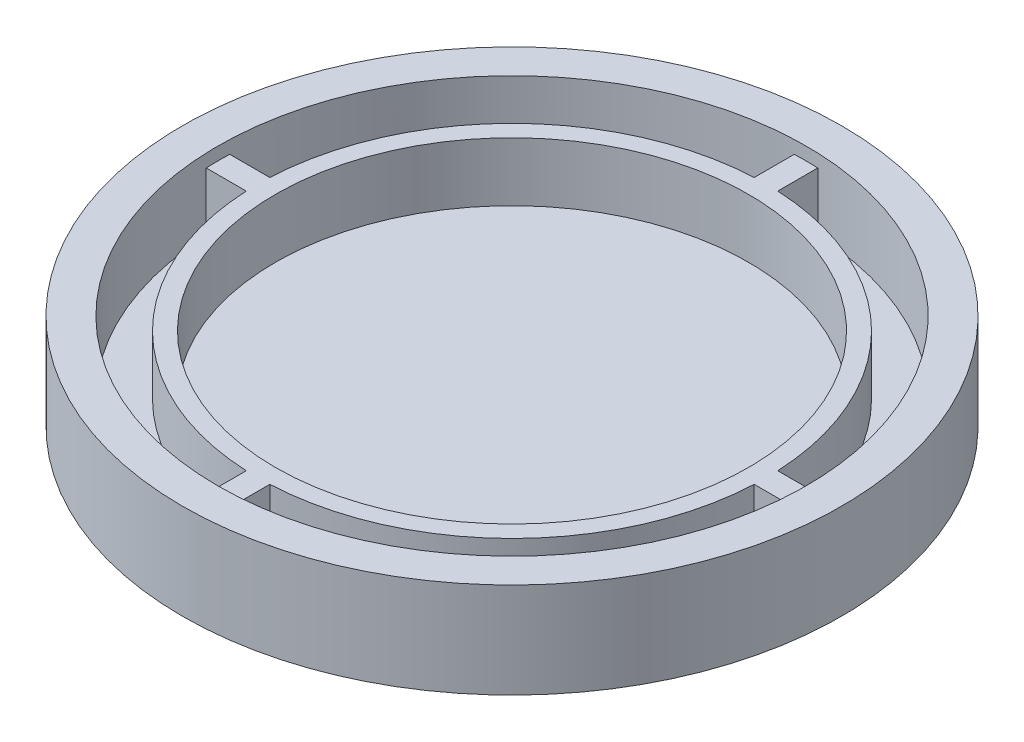
from build123d import *

# Parameters (mm, degrees)
SKETCH1_R           = 28
SKETCH1_R_2         = 25
BOSS_EXTRUDE1_DEPTH = 8
BOSS_EXTRUDE2_START = -2
SKETCH1_3_R         = 28
BOSS_EXTRUDE2_DEPTH = 2
SKETCH1_5_R         = 21.6
SKETCH1_5_R_2       = 20.1
BOSS_EXTRUDE3_DEPTH = 5
CUT_EXTRUDE1_START  = -1.9
SKETCH5_R           = 28
CUT_EXTRUDE1_DEPTH  = 1.9
SKETCH10_W          = 2
SKETCH10_H          = 3.423160565
SKETCH10_W_2        = 3.423160565
SKETCH10_H_2        = 2
BOSS_EXTRUDE4_DEPTH = 5


with BuildPart() as part:
    # Sketch1 → Boss-Extrude1 (new body)
    with BuildSketch(Plane(origin=(0, 0, 0), x_dir=(1, 0, 0), z_dir=(0, 1, 0))):
        with Locations(Location((0, 0, 0), (0, 0, 270))):
            Circle(SKETCH1_R)
        with Locations(Location((0, 0, 0), (0, 0, 270))):
            Circle(SKETCH1_R_2, mode=Mode.SUBTRACT)
    extrude(amount=BOSS_EXTRUDE1_DEPTH)

    # Sketch1<3> → Boss-Extrude2 (add)
    with BuildSketch(Plane(origin=(0, 0, 0), x_dir=(1, 0, 0), z_dir=(0, 1, 0)).offset(BOSS_EXTRUDE2_START)):
        with Locations(Location((0, 0, 0), (0, 0, 270))):
            Circle(SKETCH1_3_R)
    extrude(amount=BOSS_EXTRUDE2_DEPTH)

    # Sketch1<5> → Boss-Extrude3 (add)
    with BuildSketch(Plane(origin=(0, 0, 0), x_dir=(1, 0, 0), z_dir=(0, 1, 0))):
        with Locations(Location((0, 0, 0), (0, 0, 270))):
            Circle(SKETCH1_5_R)
        with Locations(Location((0, 0, 0), (0, 0, 270))):
            Circle(SKETCH1_5_R_2, mode=Mode.SUBTRACT)
    extrude(amount=BOSS_EXTRUDE3_DEPTH)

    # Sketch5 → Cut-Extrude1 (cut)
    with BuildSketch(Plane(origin=(0, 8, 0), x_dir=(1, 0, 0), z_dir=(0, 1, 0)).offset(CUT_EXTRUDE1_START)):
        with Locations(Location((0, 0, 0), (0, 0, 270))):
            Circle(SKETCH5_R)
    extrude(amount=CUT_EXTRUDE1_DEPTH, mode=Mode.SUBTRACT)

    # Sketch10 → Boss-Extrude4 (add)
    with BuildSketch(Plane(origin=(0, 0, 0), x_dir=(1, 0, 0), z_dir=(0, 1, 0))):
        with Locations((0, -23.288419717)):
            Rectangle(SKETCH10_W, SKETCH10_H)
        with Locations((-23.288419717, 0)):
            Rectangle(SKETCH10_W_2, SKETCH10_H_2)
        with Locations((23.288419717, 0)):
            Rectangle(SKETCH10_W_2, SKETCH10_H_2)
        with Locations((0, 23.288419717)):
            Rectangle(SKETCH10_W, SKETCH10_H)
    extrude(amount=BOSS_EXTRUDE4_DEPTH)


solid = part.part
